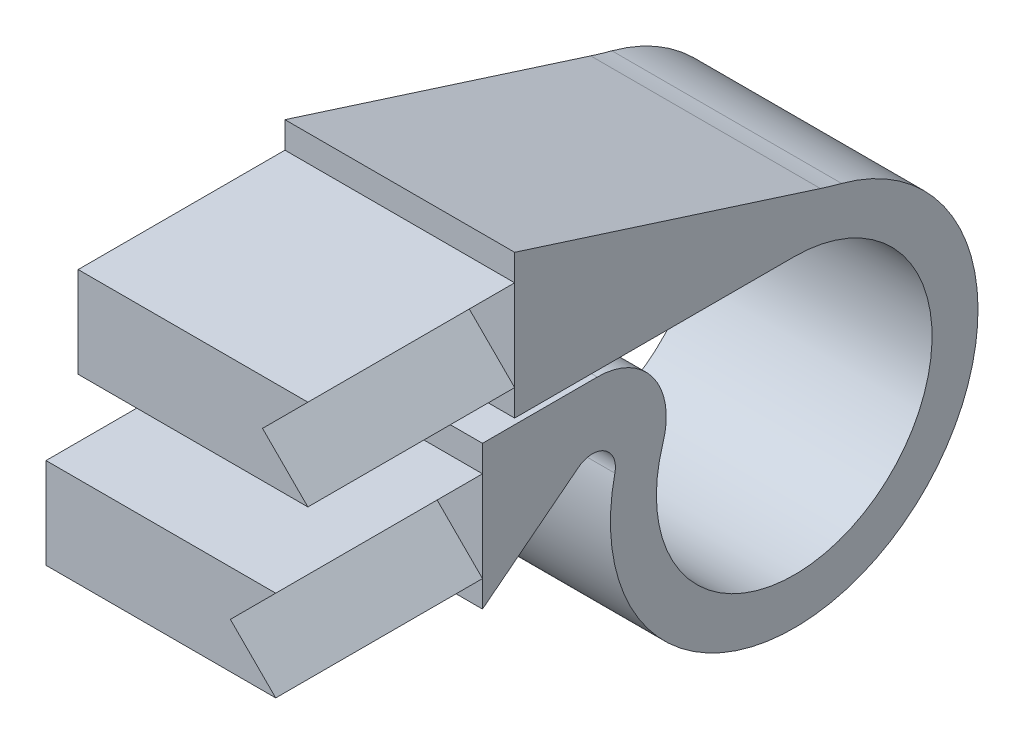
from build123d import *

# Parameters (mm, degrees)
BOSS_EXTRUDE1_DEPTH = 10
BOSS_EXTRUDE4_DEPTH = 9
BOSS_EXTRUDE5_DEPTH = 9


with BuildPart() as part:
    # Sketch1 → Boss-Extrude1 (new body)
    with BuildSketch(Plane(origin=(0, 0, 0), x_dir=(0, 0, -1), z_dir=(1, 0, 0))):
        with BuildLine():
            Line((-8.569568251, -0.25), (-13.569568251, -0.25))
            Line((-13.569568251, -0.25), (-13.569568251, -6.5))
            Line((-13.569568251, -6.5), (-9.398337093, -3.25))
            ThreePointArc((-9.398337093, -3.25), (-8.248911648, -3.193857851), (-7.80775466, -4.256736633))
            ThreePointArc((-7.80775466, -4.256736633), (4.148003929, -12.840618642), (2.063858472, 1.729197126))
            ThreePointArc((2.063858472, 1.729197126), (1.600092206, 1.859034064), (1.13958663, 2))
            Line((1.13958663, 2), (-12.169568251, 6.25))
            Line((-12.169568251, 6.25), (-12.169568251, 0))
            Line((-12.169568251, 0), (0, 0))
            ThreePointArc((0, 0), (3.535533906, -10.847679857), (-5.7130455, -4.166666667))
            ThreePointArc((-5.7130455, -4.166666667), (-6.145728322, -1.482233047), (-8.569568251, -0.25))
        make_face()
    extrude(amount=BOSS_EXTRUDE1_DEPTH)

    # Sketch2 → Boss-Extrude4 (add)
    with BuildSketch(Plane.XY.offset(12.169568251)):
        Polygon((0, 1.15), (10, 1.15), (8.025, 3.125), (10, 5.1), (0, 5.1), align=None)
    extrude(amount=BOSS_EXTRUDE4_DEPTH)

    # Sketch3 → Boss-Extrude5 (add)
    with BuildSketch(Plane.XY.offset(13.569568251)):
        Polygon((0, -5.35), (10, -5.35), (8.025, -3.375), (10, -1.4), (0, -1.4), align=None)
    extrude(amount=BOSS_EXTRUDE5_DEPTH)


solid = part.part
